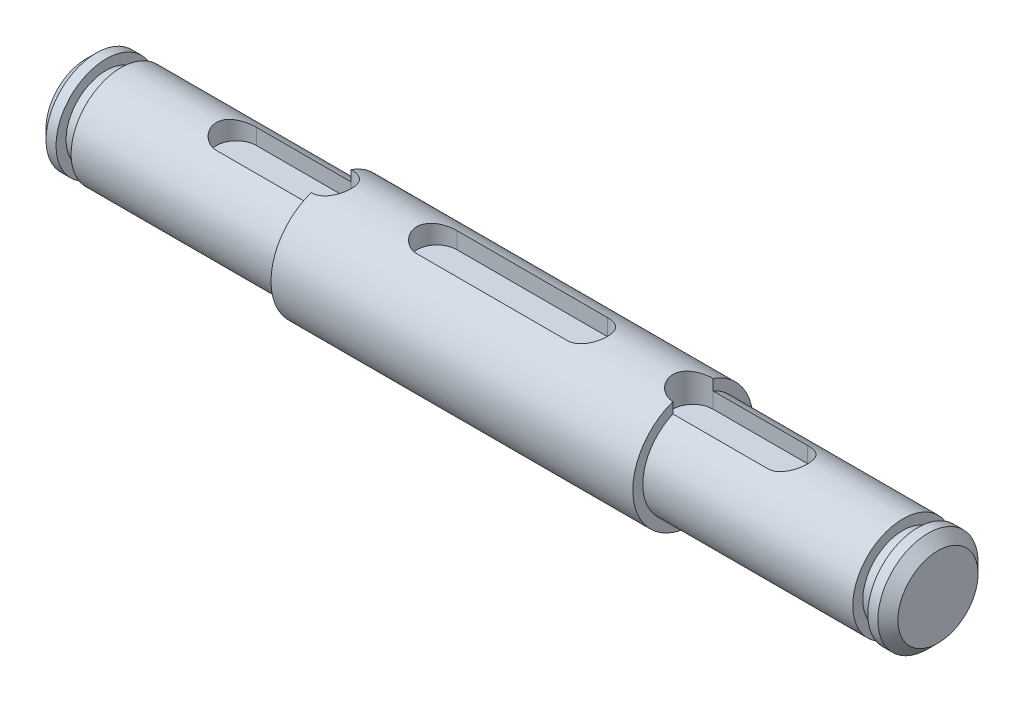
from build123d import *

# Parameters (mm, degrees)
CHAMFER1_SIZE       = 1
SKETCH3_W           = 4
SKETCH3_H           = 4
CUT_EXTRUDE1_DEPTH  = 5
CUT_EXTRUDE2_DEPTH  = 10
CUT_EXTRUDE3_START  = 1
CUT_EXTRUDE3_DEPTH  = 10
BOSS_EXTRUDE1_REACH = 46.071
SKETCH6_W           = 5
SKETCH6_H           = 4


with BuildPart() as part:
    # Sketch1 → Revolve1 (revolve)
    with BuildSketch(Plane.XY, mode=Mode.PRIVATE) as revolve1_sk:
        Polygon((-42.5, 0), (-42.5, 5), (-40.5, 5), (-40.5, 4), (-39, 4), (-39, 5), (-18.05, 5), (-18.05, 6), (18.05, 6), (18.05, 5), (39, 5), (39, 4), (40.5, 4), (40.5, 5), (42.5, 5), (42.5, 0), align=None)
    revolve(revolve1_sk.sketch.rotate(Axis((-47.151991765, 0, 0), (1, 0, 0)), 90), axis=Axis((-47.151991765, 0, 0), (1, 0, 0)))

    # Chamfer1
    chamfer1_edges = [part.edges().sort_by_distance(p)[0] for p in [
        (-42.5, 0, -5),
        (42.5, 0, -5),
    ]]
    chamfer(chamfer1_edges, length=CHAMFER1_SIZE)

    # Sketch3 → Cut-Extrude1 (cut)
    with BuildSketch(Plane(origin=(0, 0, 0), x_dir=(0, 0, -1), z_dir=(1, 0, 0))):
        with Locations((0, 5)):
            Rectangle(SKETCH3_W, SKETCH3_H)
    extrude(amount=-CUT_EXTRUDE1_DEPTH, mode=Mode.SUBTRACT)

    # Sketch4 → Cut-Extrude2 (cut)
    with BuildSketch(Plane(origin=(0, 3, 0), x_dir=(1, 0, 0), z_dir=(0, 1, 0))):
        with BuildLine():
            Line((27.5, -2), (18.05, -2))
            ThreePointArc((18.05, -2), (16.05, 0), (18.05, 2))
            Line((18.05, 2), (27.5, 2))
            ThreePointArc((27.5, 2), (29.5, 0), (27.5, -2))
        make_face()
        with BuildLine():
            Line((-18.05, 2), (-27.5, 2))
            ThreePointArc((-27.5, 2), (-29.5, 0), (-27.5, -2))
            Line((-27.5, -2), (-18.05, -2))
            ThreePointArc((-18.05, -2), (-16.05, 0), (-18.05, 2))
        make_face()
    extrude(amount=CUT_EXTRUDE2_DEPTH, mode=Mode.SUBTRACT)

    # Sketch5 → Cut-Extrude3 (cut)
    with BuildSketch(Plane(origin=(0, 3, 0), x_dir=(1, 0, 0), z_dir=(0, 1, 0)).offset(CUT_EXTRUDE3_START)):
        with BuildLine():
            Line((7.5, -2), (-7.5, -2))
            ThreePointArc((-7.5, -2), (-9.5, 0), (-7.5, 2))
            Line((-7.5, 2), (7.5, 2))
            ThreePointArc((7.5, 2), (9.5, 0), (7.5, -2))
        make_face()
    extrude(amount=CUT_EXTRUDE3_DEPTH, mode=Mode.SUBTRACT)

    # Sketch6 → Boss-Extrude1 (add, up to next)
    with BuildSketch(Plane(origin=(0, 4, 0), x_dir=(1, 0, 0), z_dir=(0, 1, 0)), mode=Mode.PRIVATE) as boss_extrude1_sk1:
        with Locations((-2.5, 0)):
            Rectangle(SKETCH6_W, SKETCH6_H)
    boss_extrude1_tool1 = extrude(boss_extrude1_sk1.sketch, amount=-BOSS_EXTRUDE1_REACH, mode=Mode.PRIVATE) - part.part
    add(boss_extrude1_tool1.solids().sort_by_distance((-2.5, 4, 0))[0])


solid = part.part
